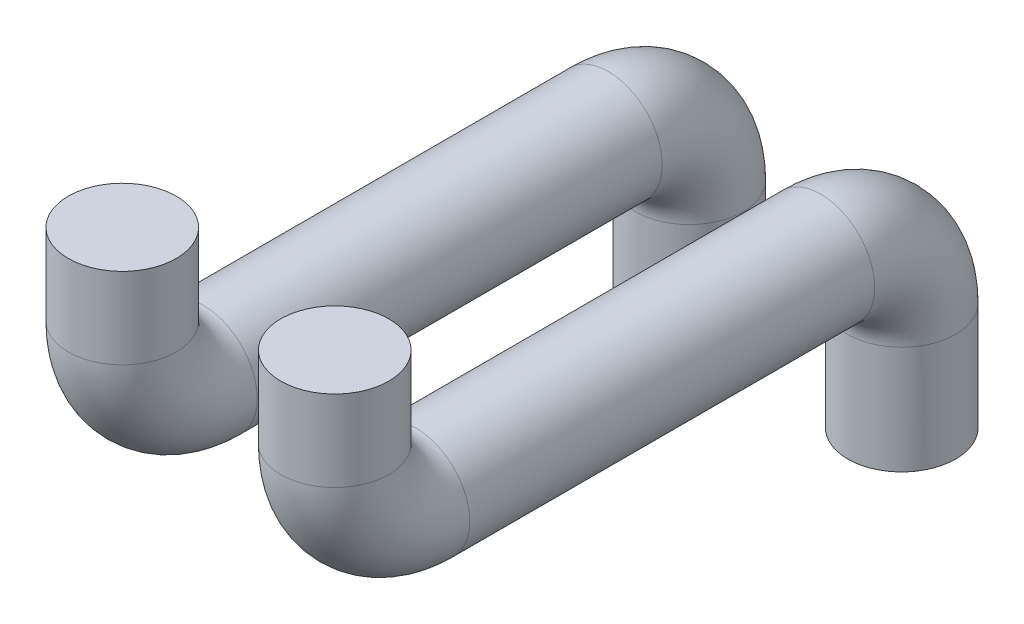
from build123d import *

# Parameters (mm, degrees)
SKETCH2_R = 2


with BuildPart() as part:
    # Sweep1: sweep along a path in Sketch1
    with BuildLine(Plane(origin=(0, 0, 0), x_dir=(0, 0, -1), z_dir=(1, 0, 0))) as sweep1_path:
        Line((-10.5, 6), (-10.5, 3))
        ThreePointArc((-10.5, 3), (-9.621320344, 0.878679656), (-7.5, 0))
        Line((-7.5, 0), (7.5, 0))
        ThreePointArc((7.5, 0), (9.621320344, -0.878679656), (10.5, -3))
        Line((10.5, -3), (10.5, -7))
    # Sketch2 → Sweep1 (sweep)
    with BuildSketch(Plane(origin=(0, 6, 0), x_dir=(1, 0, 0), z_dir=(0, 1, 0))):
        with Locations((0, -10.5)):
            Circle(SKETCH2_R)
    sweep(path=sweep1_path.line)


with BuildPart() as body_2:
    # Mirror2: mirrored copy
    add(part.part.mirror(Plane(origin=(-3.935, 0, 0), x_dir=(0, 0, 1), z_dir=(1, 0, 0))))


solid = Compound([part.part, body_2.part])
